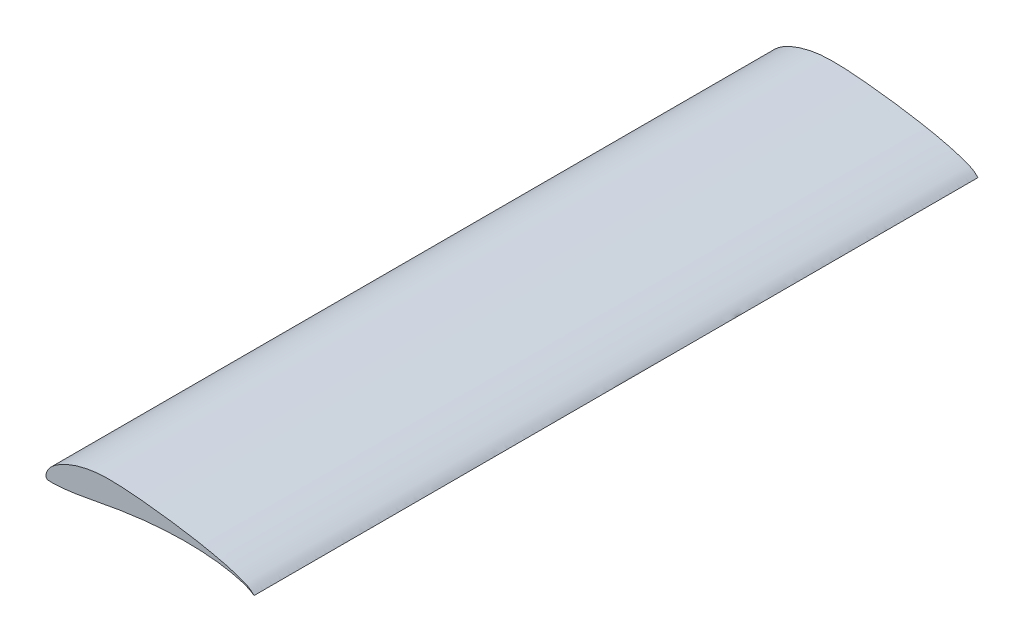
from build123d import *

# Parameters (mm, degrees)
BOSS_EXTRUDE1_DEPTH      = 508
BOSS_EXTRUDE1_DEPTH_BACK = 508


with BuildPart() as part:
    # Sketch2 → Boss-Extrude1 (new, two sides: drawn at the far end of the back side and taken through both)
    with BuildSketch(Plane.XY.offset(-BOSS_EXTRUDE1_DEPTH_BACK)):
        with BuildLine():
            add(Edge.make_bspline(
                [(292.1, 0), (292.101748689, 0.007436047), (291.141508661, 0.722880275), (290.32941212, 1.519687667), (288.526229753, 3.183976822), (286.398896153, 4.954462241), (283.488886511, 6.739308535), (279.870267404, 8.469026371), (275.501742518, 10.274196443), (270.389970768, 12.129683429), (264.558800096, 14.022379692), (258.038502143, 15.935852116), (250.86558876, 17.861119781), (243.079665675, 19.780505053), (234.725371617, 21.680113593), (225.852500238, 23.54808046), (216.515233407, 25.374802877), (206.768143256, 27.137801944), (196.672609043, 28.834558843), (186.286812137, 30.443224566), (175.677917756, 31.966940347), (164.913916248, 33.393631499), (154.072771328, 34.718732688), (143.241149724, 35.95162635), (132.508721132, 37.061203392), (121.962921004, 38.026696819), (111.677919879, 38.793763388), (101.71246946, 39.321406738), (92.122010805, 39.549267722), (82.955674469, 39.525013409), (74.230559217, 39.076202781), (65.943285177, 38.166708262), (58.06011671, 36.880669525), (50.579151208, 35.214617694), (43.50807427, 33.260939519), (36.876804497, 31.054237634), (30.713544068, 28.64611584), (25.056592205, 26.04947597), (19.924090483, 23.317037283), (15.3439614, 20.479872886), (11.344927417, 17.576428815), (7.928638532, 14.668247083), (5.144636936, 11.723582701), (3.006168605, 8.767936524), (1.426535909, 5.892486414), (0.414158521, 3.162382769), (-0.068239354, 0.64249793), (0.024876491, -1.488727364), (0.573568753, -3.443404375), (2.613145749, -4.413720363), (5.355383802, -4.549852641), (9.106755234, -4.681792579), (13.824369566, -4.478359143), (19.454908435, -4.104510483), (25.935709823, -3.505685998), (33.200457171, -2.695450722), (41.213725662, -1.656418468), (49.971599331, -0.204216291), (59.516719512, 1.6168217), (69.896805381, 3.598692143), (81.061119927, 5.691263197), (92.939539511, 7.807678917), (105.444828595, 9.868512704), (118.479970277, 11.804947923), (131.932628308, 13.545949166), (145.6818267, 15.040822678), (159.597686459, 16.222458638), (173.540558502, 17.060092831), (187.364775606, 17.520586744), (200.920369277, 17.578750425), (214.056105635, 17.230631923), (226.621572717, 16.48438076), (238.465672562, 15.349625586), (249.447394068, 13.869923851), (259.423758739, 12.088210922), (268.277798117, 10.064158572), (275.846336321, 7.898332386), (282.040404303, 5.586775704), (286.459712364, 3.471405402), (289.71795022, 1.515462967), (290.969625096, 0.758545511), (292.09821576, -0.007587221), (292.1, 0)],
                knots=[0, 0, 0, 0, 0.000979678, 0.003648862, 0.007483499, 0.012095277, 0.017525591, 0.02405178, 0.031783051, 0.040677828, 0.050710301, 0.061833229, 0.07398925, 0.087118173, 0.101145049, 0.115990637, 0.131570422, 0.147788379, 0.164550917, 0.181757895, 0.199311955, 0.217095072, 0.234990228, 0.252856883, 0.270540594, 0.287886779, 0.304773438, 0.321101419, 0.336806063, 0.351800033, 0.366031063, 0.379615675, 0.392652963, 0.405170359, 0.417171919, 0.428603517, 0.439418959, 0.449596586, 0.459102079, 0.467907878, 0.475988301, 0.483308969, 0.489874508, 0.49580325, 0.501149412, 0.505903073, 0.510046769, 0.513579311, 0.516446927, 0.519350053, 0.523823355, 0.529973794, 0.537715654, 0.546967844, 0.557637367, 0.569620481, 0.582804124, 0.597246961, 0.613135037, 0.6304436, 0.649056124, 0.668822257, 0.689594964, 0.711189651, 0.733426689, 0.756094118, 0.778988554, 0.801889683, 0.824566598, 0.846792285, 0.868338291, 0.888978163, 0.908492011, 0.926658768, 0.943286193, 0.95816921, 0.971135822, 0.981955623, 0.990251791, 0.995852565, 0.999000406, 1, 1, 1, 1], degree=3))
        make_face()
    extrude(amount=BOSS_EXTRUDE1_DEPTH + BOSS_EXTRUDE1_DEPTH_BACK)


solid = part.part
